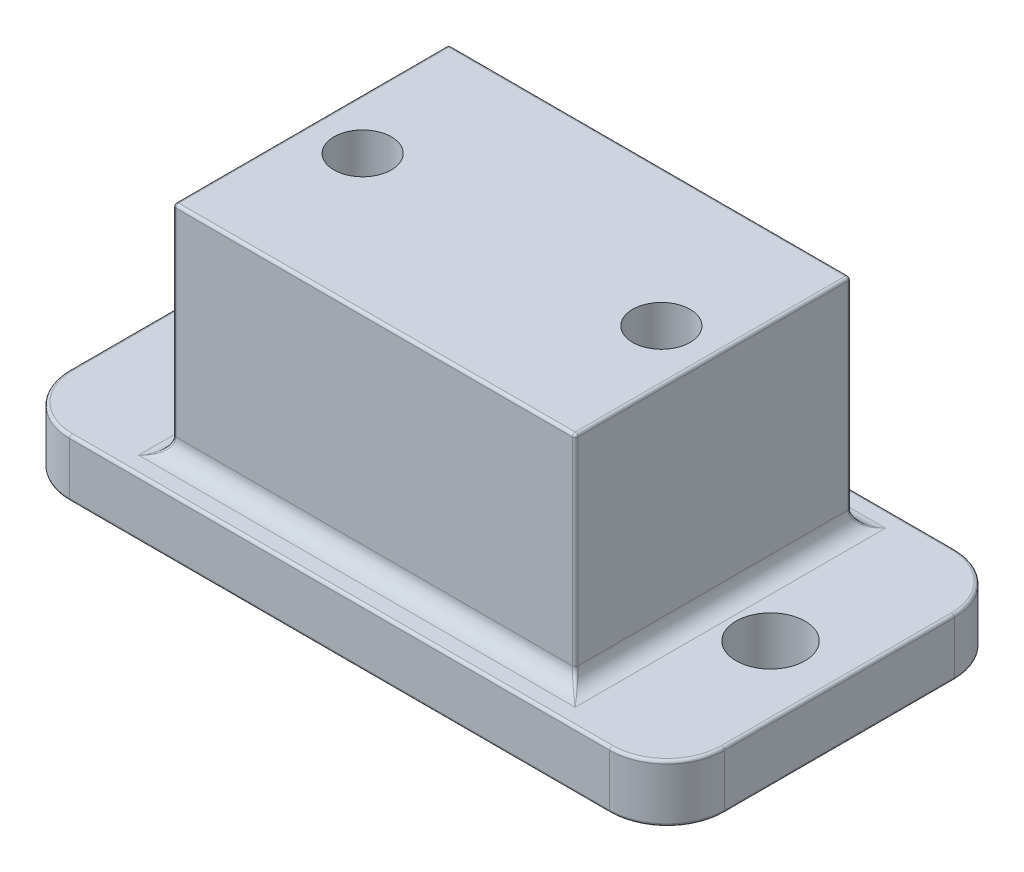
from build123d import *

# Parameters (mm, degrees)
SKETCH1_R           = 3
BOSS_EXTRUDE1_DEPTH = 5
SKETCH2_W           = 35
SKETCH2_H           = 19
BOSS_EXTRUDE2_DEPTH = 12
SKETCH3_R           = 2.5
CUT_EXTRUDE1_DEPTH  = 13
FILLET1_R           = 1.5
FILLET2_R           = 0.25
FILLET3_R           = 0.25


with BuildPart() as part:
    # Sketch1 → Boss-Extrude1 (new body)
    with BuildSketch(Plane(origin=(0, 0, 0), x_dir=(1, 0, 0), z_dir=(0, 1, 0))):
        with BuildLine():
            Line((23.5, -15), (-23.5, -15))
            ThreePointArc((-23.5, -15), (-27.035533906, -13.535533906), (-28.5, -10))
            Line((-28.5, -10), (-28.5, 10))
            ThreePointArc((-28.5, 10), (-27.035533906, 13.535533906), (-23.5, 15))
            Line((-23.5, 15), (23.5, 15))
            ThreePointArc((23.5, 15), (27.035533906, 13.535533906), (28.5, 10))
            Line((28.5, 10), (28.5, -10))
            ThreePointArc((28.5, -10), (27.035533906, -13.535533906), (23.5, -15))
        make_face()
        with Locations(Location((-22.5, 0, 0), (0, 0, 270))):
            Circle(SKETCH1_R, mode=Mode.SUBTRACT)
        with Locations(Location((22.5, 0, 0), (0, 0, 270))):
            Circle(SKETCH1_R, mode=Mode.SUBTRACT)
    extrude(amount=BOSS_EXTRUDE1_DEPTH)

    # Sketch2 → Boss-Extrude2 (add, symmetric)
    with BuildSketch(Plane.XY):
        with Locations((0, 14.5)):
            Rectangle(SKETCH2_W, SKETCH2_H)
    extrude(amount=BOSS_EXTRUDE2_DEPTH, both=True)

    # Sketch3 → Cut-Extrude1 (cut)
    with BuildSketch(Plane(origin=(0, 24, 0), x_dir=(1, 0, 0), z_dir=(0, 1, 0))):
        with Locations(Location((-13, 0, 0), (0, 0, 180))):
            Circle(SKETCH3_R)
        with Locations(Location((13, 0, 0), (0, 0, 180))):
            Circle(SKETCH3_R)
    extrude(amount=-CUT_EXTRUDE1_DEPTH, mode=Mode.SUBTRACT)

    # Fillet1
    fillet1_edges = [part.edges().sort_by_distance(p)[0] for p in [
        (0, 5, -12),
        (-17.5, 5, 0),
        (17.5, 5, 0),
        (0, 5, 12),
    ]]
    fillet(fillet1_edges, radius=FILLET1_R)

    # Fillet2
    fillet2_edges = [part.edges().sort_by_distance(p)[0] for p in [
        (28.5, 0, 0),
        (27.035533906, 0, 13.535533906),
        (0, 0, 15),
        (-27.035533906, 0, 13.535533906),
        (27.035533906, 5, 13.535533906),
        (28.5, 5, 0),
        (27.035533906, 5, -13.535533906),
        (0, 5, -15),
        (-27.035533906, 5, -13.535533906),
        (-28.5, 5, 0),
        (-27.035533906, 5, 13.535533906),
        (-28.5, 0, 0),
        (0, 5, 15),
        (-27.035533906, 0, -13.535533906),
        (0, 0, -15),
        (27.035533906, 0, -13.535533906),
    ]]
    fillet(fillet2_edges, radius=FILLET2_R)

    # Fillet3
    fillet3_edges = [part.edges().sort_by_distance(p)[0] for p in [
        (-17.5, 15.25, -12),
        (-17.5, 24, 0),
        (0, 24, -12),
        (17.5, 24, 0),
        (-17.5, 15.25, 12),
        (0, 24, 12),
        (17.5, 15.25, -12),
        (17.5, 15.25, 12),
        (18.030926639, 5.355055975, 12.530926639),
        (18.030926639, 5.355055975, -12.530926639),
        (-18.030926639, 5.355055975, 12.530926639),
        (-18.030926639, 5.355055975, -12.530926639),
    ]]
    fillet(fillet3_edges, radius=FILLET3_R)


solid = part.part
